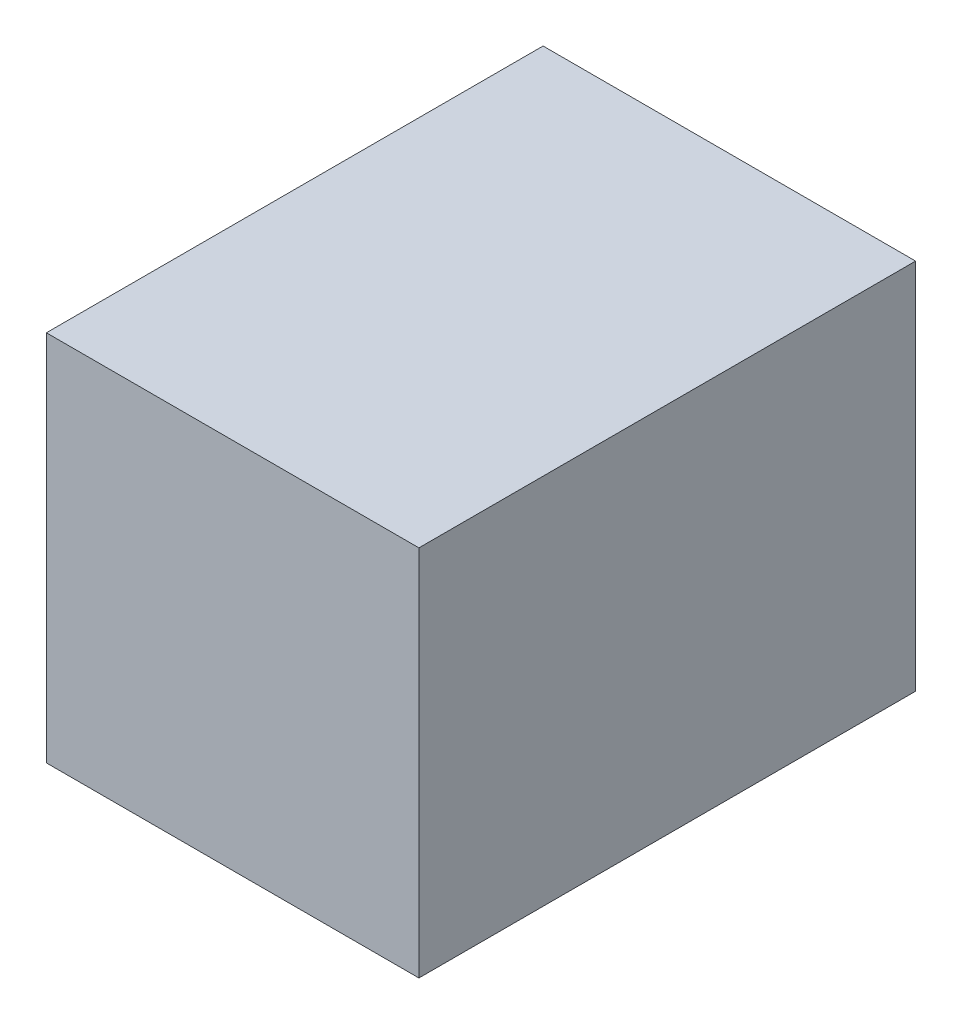
from build123d import *

# Parameters (mm, degrees)
SKETCH1_W           = 30
SKETCH1_H           = 30
BOSS_EXTRUDE1_DEPTH = 40


with BuildPart() as part:
    # Sketch1 → Boss-Extrude1 (new body)
    with BuildSketch(Plane.XY):
        Rectangle(SKETCH1_W, SKETCH1_H)
    extrude(amount=BOSS_EXTRUDE1_DEPTH)


solid = part.part
